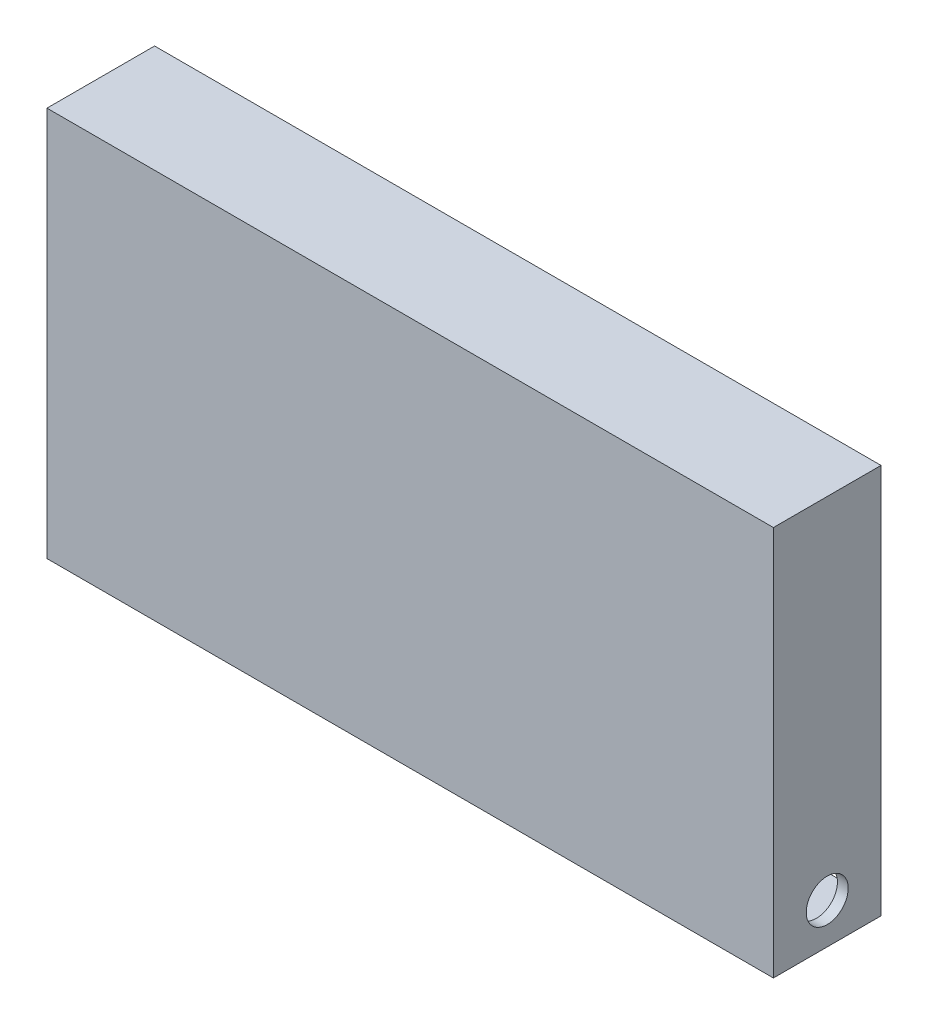
from build123d import *

# Parameters (mm, degrees)
SKETCH3_W            = 135
SKETCH3_H            = 72.5
BOSS_EXTRUDE1_DEPTH  = 20
SKETCH4_W            = 131
SKETCH4_H            = 68.5
CUT_EXTRUDE1_DEPTH   = 18
SKETCH6_W            = 23
SKETCH6_H            = 45.9
BOSS_EXTRUDE2_DEPTH  = 8
SKETCH5_W            = 21.8
SKETCH5_H            = 43.5
CUT_EXTRUDE2_DEPTH   = 18
SKETCH7_W            = 1.2
SKETCH7_H            = 8.3
SKETCH7_H_2          = 11.3
BOSS_EXTRUDE5_DEPTH  = 8
SKETCH9_W            = 1.2
SKETCH9_H            = 65.5
BOSS_EXTRUDE6_DEPTH  = 8
SKETCH11_W           = 26.8
SKETCH11_H           = 36
BOSS_EXTRUDE7_DEPTH  = 8
SKETCH10_W           = 25.6
SKETCH10_H           = 33.6
CUT_EXTRUDE3_DEPTH   = 8
SKETCH13_W           = 8
SKETCH13_H           = 33.6
CUT_EXTRUDE4_DEPTH   = 1.2
SKETCH14_R           = 3.9
CUT_EXTRUDE5_DEPTH   = 2
SKETCH15_R           = 5.4
CUT_EXTRUDE6_DEPTH   = 2
SKETCH18_W           = 5
SKETCH18_H           = 5
BOSS_EXTRUDE8_DEPTH  = 5
SKETCH19_R           = 1.5
CUT_EXTRUDE7_DEPTH   = 8
SKETCH20_W           = 5
SKETCH20_H           = 5
BOSS_EXTRUDE9_DEPTH  = 5
SKETCH21_R           = 1.5
CUT_EXTRUDE8_DEPTH   = 5
SKETCH23_W           = 7
SKETCH23_H           = 7
BOSS_EXTRUDE10_DEPTH = 5
SKETCH24_R           = 1.5
CUT_EXTRUDE10_DEPTH  = 5


with BuildPart() as part:
    # Sketch3 → Boss-Extrude1 (new body)
    with BuildSketch(Plane.XY):
        Rectangle(SKETCH3_W, SKETCH3_H)
    extrude(amount=BOSS_EXTRUDE1_DEPTH)

    # Sketch4 → Cut-Extrude1 (cut)
    with BuildSketch(Plane(origin=(0, 0, 0), x_dir=(-1, 0, 0), z_dir=(0, 0, -1))):
        Rectangle(SKETCH4_W, SKETCH4_H)
    extrude(amount=-CUT_EXTRUDE1_DEPTH, mode=Mode.SUBTRACT)

    # Sketch6 → Boss-Extrude2 (add)
    with BuildSketch(Plane(origin=(0, 0, 18), x_dir=(-1, 0, 0), z_dir=(0, 0, -1))):
        with Locations((-54, 0)):
            Rectangle(SKETCH6_W, SKETCH6_H)
    extrude(amount=BOSS_EXTRUDE2_DEPTH)

    # Sketch5 → Cut-Extrude2 (cut)
    with BuildSketch(Plane(origin=(0, 0, 18), x_dir=(-1, 0, 0), z_dir=(0, 0, -1))):
        with Locations((-54.6, 0)):
            Rectangle(SKETCH5_W, SKETCH5_H)
    extrude(amount=CUT_EXTRUDE2_DEPTH, mode=Mode.SUBTRACT)

    # Sketch7 → Boss-Extrude5 (add)
    with BuildSketch(Plane(origin=(0, 0, 18), x_dir=(-1, 0, 0), z_dir=(0, 0, -1))):
        with Locations((-43.1, -27.1)):
            Rectangle(SKETCH7_W, SKETCH7_H)
        with Locations((-43.1, 28.6)):
            Rectangle(SKETCH7_W, SKETCH7_H_2)
    extrude(amount=BOSS_EXTRUDE5_DEPTH)

    # Sketch9 → Boss-Extrude6 (add)
    with BuildSketch(Plane(origin=(0, 0, 18), x_dir=(-1, 0, 0), z_dir=(0, 0, -1))):
        with Locations((25.55, 1.5)):
            Rectangle(SKETCH9_W, SKETCH9_H)
    extrude(amount=BOSS_EXTRUDE6_DEPTH)

    # Sketch11 → Boss-Extrude7 (add)
    with BuildSketch(Plane(origin=(0, 0, 18), x_dir=(-1, 0, 0), z_dir=(0, 0, -1))):
        with Locations((39.55, 0)):
            Rectangle(SKETCH11_W, SKETCH11_H)
    extrude(amount=BOSS_EXTRUDE7_DEPTH)

    # Sketch10 → Cut-Extrude3 (cut)
    with BuildSketch(Plane(origin=(0, 0, 18), x_dir=(-1, 0, 0), z_dir=(0, 0, -1))):
        with Locations((38.95, 0)):
            Rectangle(SKETCH10_W, SKETCH10_H)
    extrude(amount=CUT_EXTRUDE3_DEPTH, mode=Mode.SUBTRACT)

    # Sketch13 → Cut-Extrude4 (cut)
    with BuildSketch(Plane.ZY.offset(52.95)):
        with Locations((14, 0)):
            Rectangle(SKETCH13_W, SKETCH13_H)
    extrude(amount=-CUT_EXTRUDE4_DEPTH, mode=Mode.SUBTRACT)

    # Sketch14 → Cut-Extrude5 (cut)
    with BuildSketch(Plane(origin=(67.5, 0, 0), x_dir=(0, 0, -1), z_dir=(1, 0, 0))):
        with Locations((-10, -28.75)):
            Circle(SKETCH14_R)
    extrude(amount=-CUT_EXTRUDE5_DEPTH, mode=Mode.SUBTRACT)

    # Sketch15 → Cut-Extrude6 (cut)
    with BuildSketch(Plane.ZY.offset(67.5)):
        with Locations((10, 26.25)):
            Circle(SKETCH15_R)
        with Locations((10, 11.25)):
            Circle(SKETCH15_R)
        with Locations((10, -3.75)):
            Circle(SKETCH15_R)
    extrude(amount=-CUT_EXTRUDE6_DEPTH, mode=Mode.SUBTRACT)

    # Sketch18 → Boss-Extrude8 (add)
    with BuildSketch(Plane(origin=(0, 0, 18), x_dir=(-1, 0, 0), z_dir=(0, 0, -1))):
        with Locations((39.55, -14.3)):
            Rectangle(SKETCH18_W, SKETCH18_H)
        with Locations((39.55, 14.3)):
            Rectangle(SKETCH18_W, SKETCH18_H)
    extrude(amount=BOSS_EXTRUDE8_DEPTH)

    # Sketch19 → Cut-Extrude7 (cut)
    with BuildSketch(Plane(origin=(0, 0, 10), x_dir=(-1, 0, 0), z_dir=(0, 0, -1))):
        with Locations((39.663798911, -14.3)):
            Circle(SKETCH19_R)
        with Locations((39.663798911, 14.3)):
            Circle(SKETCH19_R)
    extrude(amount=-CUT_EXTRUDE7_DEPTH, mode=Mode.SUBTRACT)

    # Sketch20 → Boss-Extrude9 (add)
    with BuildSketch(Plane(origin=(0, 0, 18), x_dir=(-1, 0, 0), z_dir=(0, 0, -1))):
        with Locations((-46.2, 16.25)):
            Rectangle(SKETCH20_W, SKETCH20_H)
        with Locations((-63, -16.25)):
            Rectangle(SKETCH20_W, SKETCH20_H)
    extrude(amount=BOSS_EXTRUDE9_DEPTH)

    # Sketch21 → Cut-Extrude8 (cut)
    with BuildSketch(Plane(origin=(0, 0, 13), x_dir=(-1, 0, 0), z_dir=(0, 0, -1))):
        with Locations((-46.2, 16.25)):
            Circle(SKETCH21_R)
        with Locations((-63, -16.25)):
            Circle(SKETCH21_R)
    extrude(amount=-CUT_EXTRUDE8_DEPTH, mode=Mode.SUBTRACT)

    # Sketch23 → Boss-Extrude10 (add)
    with BuildSketch(Plane(origin=(0, 0, 18), x_dir=(-1, 0, 0), z_dir=(0, 0, -1))):
        with Locations((-39, 30.75)):
            Rectangle(SKETCH23_W, SKETCH23_H)
        with Locations((21.45, 30.75)):
            Rectangle(SKETCH23_W, SKETCH23_H)
        with Locations((21.45, -27.75)):
            Rectangle(SKETCH23_W, SKETCH23_H)
        with Locations((-39, -27.75)):
            Rectangle(SKETCH23_W, SKETCH23_H)
    extrude(amount=BOSS_EXTRUDE10_DEPTH)

    # Sketch24 → Cut-Extrude10 (cut)
    with BuildSketch(Plane(origin=(0, 0, 13), x_dir=(-1, 0, 0), z_dir=(0, 0, -1))):
        with Locations((-39, 30.75)):
            Circle(SKETCH24_R)
        with Locations((21.45, 30.75)):
            Circle(SKETCH24_R)
        with Locations((21.45, -27.75)):
            Circle(SKETCH24_R)
        with Locations((-39, -27.75)):
            Circle(SKETCH24_R)
    extrude(amount=-CUT_EXTRUDE10_DEPTH, mode=Mode.SUBTRACT)


solid = part.part
